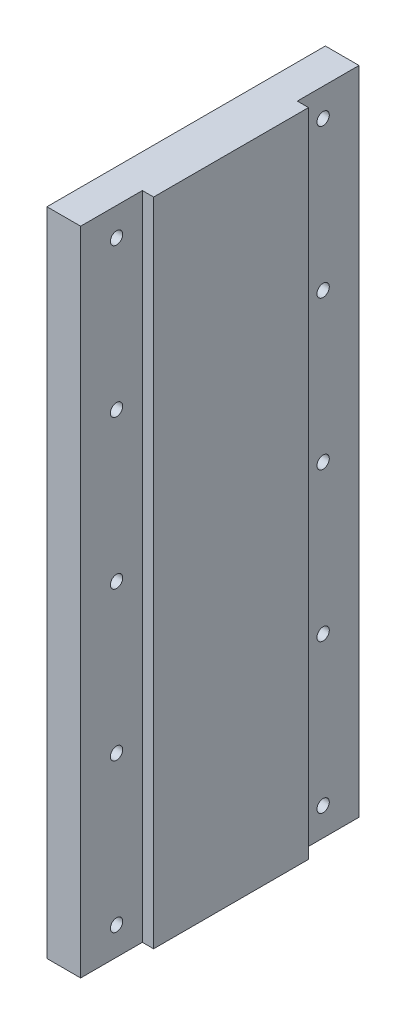
from build123d import *

# Parameters (mm, degrees)
BOSS_EXTRUDE1_DEPTH        = 580
CUT_EXTRUDE1_REACH         = 633.509
SKETCH2_R                  = 5.5
CHAMFER1_SIZE              = 6
LPATTERN1_COUNT            = 5
LPATTERN1_PITCH            = 132.5
LPATTERN1_COUNT_DIR2       = 2
LPATTERN1_PITCH_DIR2       = 184
CHAMFER1_OF_LPATTERN1_SIZE = 6


with BuildPart() as part:
    # Sketch1 → Boss-Extrude1 (new body)
    with BuildSketch(Plane(origin=(0, 0, 0), x_dir=(1, 0, 0), z_dir=(0, 1, 0))):
        Polygon((0, 0), (0, -248), (30, -248), (30, -193), (40, -193), (40, -55), (30, -55), (30, 0), align=None)
    extrude(amount=BOSS_EXTRUDE1_DEPTH)

    # Sketch2 → Cut-Extrude1 (cut, up to next)
    with BuildSketch(Plane(origin=(30, 0, 0), x_dir=(0, 0, -1), z_dir=(1, 0, 0)), mode=Mode.PRIVATE) as cut_extrude1_sk1:
        with Locations((-32, 25)):
            Circle(SKETCH2_R)
    cut_extrude1_tool1 = extrude(cut_extrude1_sk1.sketch, amount=-CUT_EXTRUDE1_REACH, mode=Mode.PRIVATE) & part.part
    cut_extrude1 = cut_extrude1_tool1.solids().sort_by_distance((30, 25, 32))[0]
    add(cut_extrude1, mode=Mode.SUBTRACT)

    # Chamfer1
    chamfer1_edges = [part.edges().sort_by_distance(p)[0] for p in [
        (0, 25, 37.5),
    ]]
    chamfer(chamfer1_edges, length=CHAMFER1_SIZE)

    # LPattern1: Cut-Extrude1 5 × 2
    with Locations(*[(0, i * LPATTERN1_PITCH, j * LPATTERN1_PITCH_DIR2) for i in range(LPATTERN1_COUNT) for j in range(LPATTERN1_COUNT_DIR2) if (i, j) != (0, 0)]):
        add(cut_extrude1, mode=Mode.SUBTRACT)

    # Chamfer1 of LPattern1
    chamfer1_of_lpattern1_edges = [part.edges().sort_by_distance(p)[0] for p in [
        (0, 25, 221.5),
        (0, 157.5, 37.5),
        (0, 157.5, 221.5),
        (0, 290, 37.5),
        (0, 290, 221.5),
        (0, 422.5, 37.5),
        (0, 422.5, 221.5),
        (0, 555, 37.5),
        (0, 555, 221.5),
    ]]
    chamfer(chamfer1_of_lpattern1_edges, length=CHAMFER1_OF_LPATTERN1_SIZE)


solid = part.part
